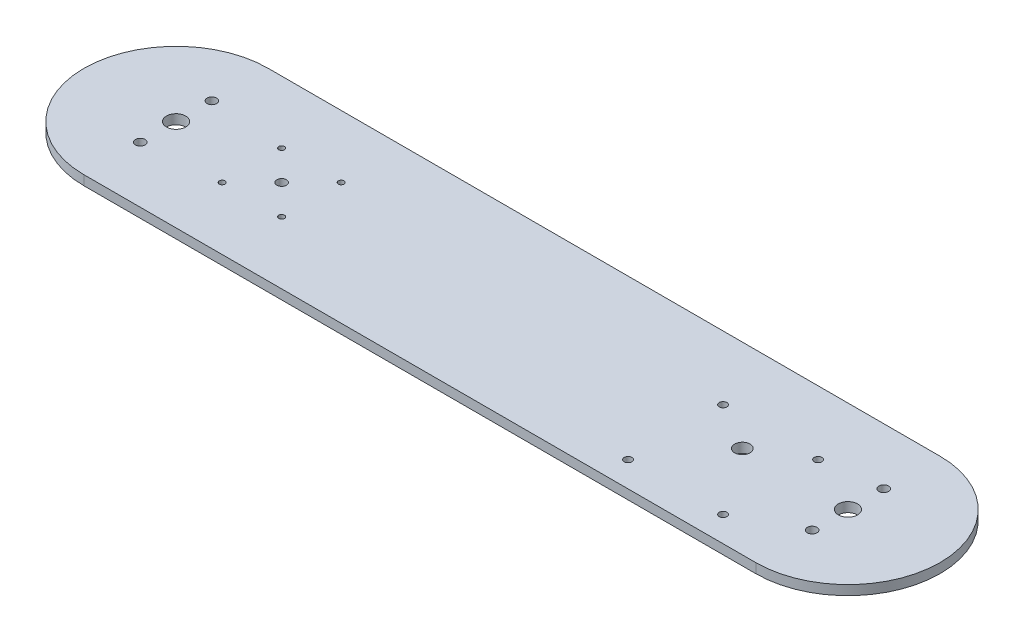
from build123d import *

# Parameters (mm, degrees)
BOSS_EXTRUDE1_DEPTH = 5
SKETCH2_R           = 5
SKETCH2_R_2         = 2.5
SKETCH2_R_3         = 4
SKETCH2_R_4         = 2
SKETCH2_R_5         = 1.5
CUT_EXTRUDE1_DEPTH  = 10


with BuildPart() as part:
    # Sketch1 → Boss-Extrude1 (new body)
    with BuildSketch(Plane(origin=(0, 0, 0), x_dir=(1, 0, 0), z_dir=(0, 1, 0))):
        with BuildLine():
            Line((-175, 48), (175, 48))
            ThreePointArc((175, 48), (223, 0), (175, -48))
            Line((175, -48), (-175, -48))
            ThreePointArc((-175, -48), (-223, 0), (-175, 48))
        make_face()
    extrude(amount=BOSS_EXTRUDE1_DEPTH)

    # Sketch2 → Cut-Extrude1 (cut)
    with BuildSketch(Plane.XZ):
        with Locations((175, 0)):
            Circle(SKETCH2_R)
        with Locations((175, 18.65)):
            Circle(SKETCH2_R_2)
        with Locations((175, -18.65)):
            Circle(SKETCH2_R_2)
        with Locations((-175, -18.65)):
            Circle(SKETCH2_R_2)
        with Locations((-175, 18.65)):
            Circle(SKETCH2_R_2)
        with Locations((-175, 0)):
            Circle(SKETCH2_R)
        with Locations((120, 0)):
            Circle(SKETCH2_R_3)
        with Locations((95.25, -14.7)):
            Circle(SKETCH2_R_4)
        with Locations((144.75, -14.7)):
            Circle(SKETCH2_R_4)
        with Locations((144.75, 34.8)):
            Circle(SKETCH2_R_4)
        with Locations((95.25, 34.8)):
            Circle(SKETCH2_R_4)
        with Locations((-135.5, -15.5)):
            Circle(SKETCH2_R_5)
        with Locations((-135.5, 15.5)):
            Circle(SKETCH2_R_5)
        with Locations((-104.5, 15.5)):
            Circle(SKETCH2_R_5)
        with Locations((-104.5, -15.5)):
            Circle(SKETCH2_R_5)
        with Locations((-120, 0)):
            Circle(SKETCH2_R_2)
    extrude(amount=-CUT_EXTRUDE1_DEPTH, mode=Mode.SUBTRACT)


solid = part.part
